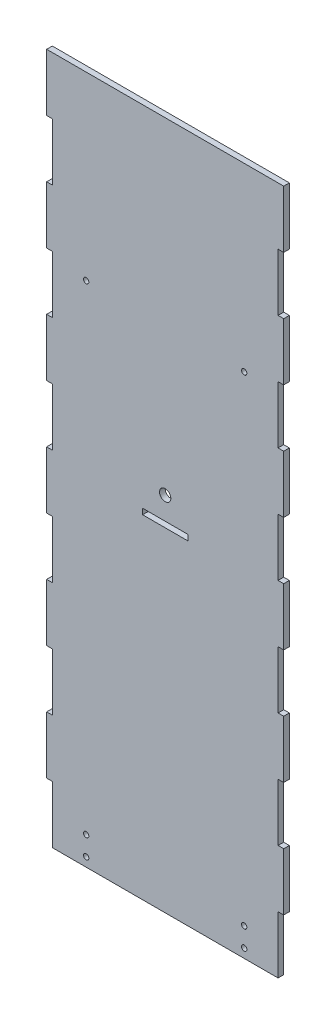
from build123d import *

# Parameters (mm, degrees)
SKETCH1_W           = 25.4
SKETCH1_H           = 3.175
SKETCH1_R           = 3.175
SKETCH1_W_2         = 3.175
SKETCH1_H_2         = 32.279166667
SKETCH1_H_3         = 32.279166666
BOSS_EXTRUDE1_DEPTH = 3.175
SKETCH2_R           = 1.5
CUT_EXTRUDE1_DEPTH  = 394.059357795


with BuildPart() as part:
    # Sketch1 → Boss-Extrude1 (new body)
    # profile 1 of 13: a face of its own
    with BuildSketch(Plane.XY):
        Polygon((63.5, 387.35), (-63.5, 387.35), (-63.5, 355.070833333), (-63.5, 322.791666667), (-63.5, 290.5125), (-63.5, 258.233333333), (-63.5, 225.954166667), (-63.5, 193.675), (-63.5, 161.395833333), (-63.5, 129.116666667), (-63.5, 96.8375), (-63.5, 64.558333333), (-63.5, 32.279166667), (-63.5, 0), (63.5, 0), (63.5, 32.279166667), (63.5, 64.558333333), (63.5, 96.8375), (63.5, 129.116666667), (63.5, 161.395833333), (63.5, 193.675), (63.5, 225.954166667), (63.5, 258.233333333), (63.5, 290.5125), (63.5, 322.791666667), (63.5, 355.070833333), align=None)
        with Locations((0, 189.1665)):
            Rectangle(SKETCH1_W, SKETCH1_H, mode=Mode.SUBTRACT)
        with Locations((0, 203.454)):
            Circle(SKETCH1_R, mode=Mode.SUBTRACT)
    # profile 2 of 13: a face of its own
    with BuildSketch(Plane.XY):
        with Locations((-65.0875, 371.210416667)):
            Rectangle(SKETCH1_W_2, SKETCH1_H_2)
    # profile 3 of 13: a face of its own
    with BuildSketch(Plane.XY):
        with Locations((-65.0875, 306.652083334)):
            Rectangle(SKETCH1_W_2, SKETCH1_H_2)
    # profile 4 of 13: a face of its own
    with BuildSketch(Plane.XY):
        with Locations((-65.0875, 242.09375)):
            Rectangle(SKETCH1_W_2, SKETCH1_H_3)
    # profile 5 of 13: a face of its own
    with BuildSketch(Plane.XY):
        with Locations((-65.0875, 177.535416666)):
            Rectangle(SKETCH1_W_2, SKETCH1_H_2)
    # profile 6 of 13: a face of its own
    with BuildSketch(Plane.XY):
        with Locations((65.0875, 371.210416667)):
            Rectangle(SKETCH1_W_2, SKETCH1_H_2)
    # profile 7 of 13: a face of its own
    with BuildSketch(Plane.XY):
        with Locations((65.0875, 306.652083334)):
            Rectangle(SKETCH1_W_2, SKETCH1_H_2)
    # profile 8 of 13: a face of its own
    with BuildSketch(Plane.XY):
        with Locations((65.0875, 242.09375)):
            Rectangle(SKETCH1_W_2, SKETCH1_H_3)
    # profile 9 of 13: a face of its own
    with BuildSketch(Plane.XY):
        with Locations((65.0875, 177.535416666)):
            Rectangle(SKETCH1_W_2, SKETCH1_H_2)
    # profile 10 of 13: a face of its own
    with BuildSketch(Plane.XY):
        with Locations((65.0875, 112.977083334)):
            Rectangle(SKETCH1_W_2, SKETCH1_H_2)
    # profile 11 of 13: a face of its own
    with BuildSketch(Plane.XY):
        with Locations((-65.0875, 112.977083334)):
            Rectangle(SKETCH1_W_2, SKETCH1_H_2)
    # profile 12 of 13: a face of its own
    with BuildSketch(Plane.XY):
        with Locations((-65.0875, 48.41875)):
            Rectangle(SKETCH1_W_2, SKETCH1_H_3)
    # profile 13 of 13: a face of its own
    with BuildSketch(Plane.XY):
        with Locations((65.0875, 48.41875)):
            Rectangle(SKETCH1_W_2, SKETCH1_H_3)
    extrude(amount=BOSS_EXTRUDE1_DEPTH)

    # Sketch2 → Cut-Extrude1 (cut, through all)
    with BuildSketch(Plane.XY.offset(3.175)):
        with Locations((-44.45, 285.75)):
            Circle(SKETCH2_R)
        with Locations((44.45, 285.75)):
            Circle(SKETCH2_R)
        with Locations((-44.45, 15.875)):
            Circle(SKETCH2_R)
        with Locations((44.45, 15.875)):
            Circle(SKETCH2_R)
        with Locations((-44.45, 5.08)):
            Circle(SKETCH2_R)
        with Locations((44.45, 5.08)):
            Circle(SKETCH2_R)
    extrude(amount=-CUT_EXTRUDE1_DEPTH, mode=Mode.SUBTRACT)


solid = part.part
